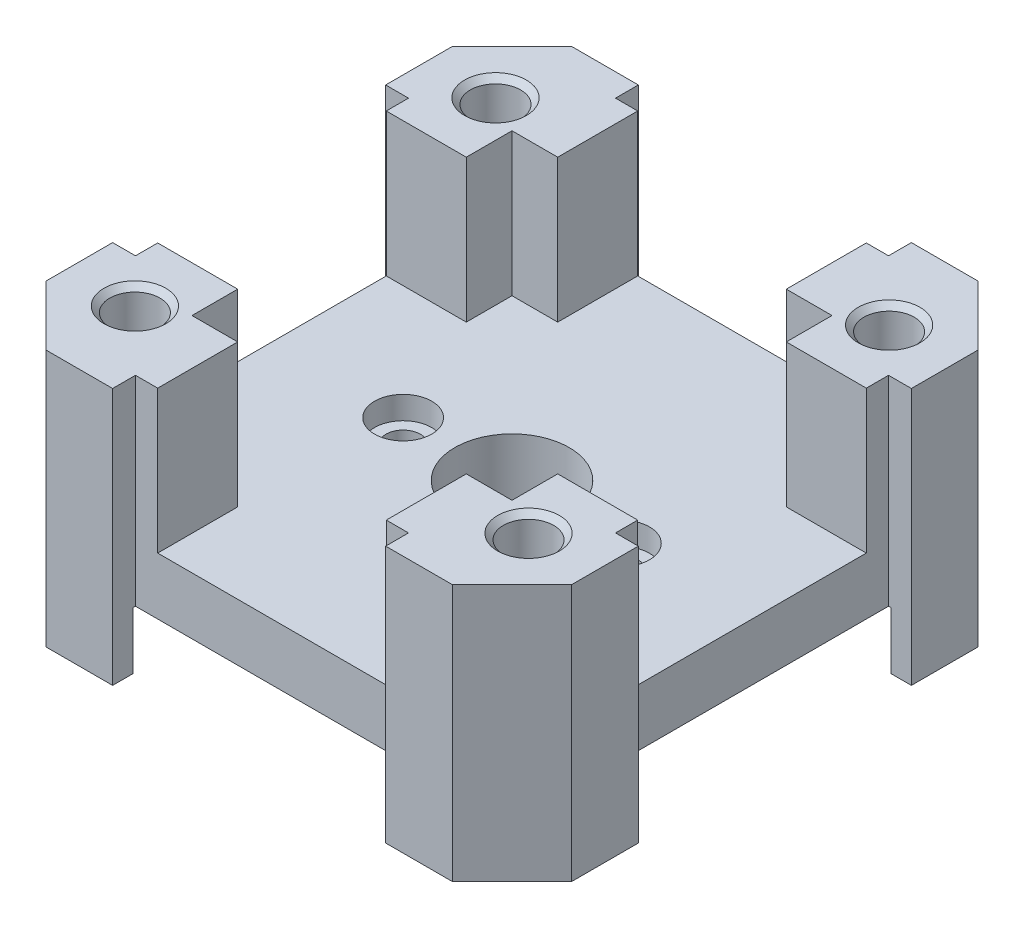
from build123d import *

# Parameters (mm, degrees)
SKETCH1_R               = 1.5
SKETCH1_R_2             = 5
BOSS_EXTRUDE1_DEPTH     = 5
SKETCH2_W               = 28
SKETCH2_H               = 28
BOSS_EXTRUDE2_DEPTH     = 12.5
SKETCH3_R               = 2.2
CUT_EXTRUDE1_DEPTH      = 6
CUT_EXTRUDE2_DEPTH      = 62.921321045
CUT_EXTRUDE2_DEPTH_BACK = 62.921321045
SKETCH4_W               = 20
SKETCH4_H               = 23.078544061
CUT_EXTRUDE3_DEPTH      = 62.921321045
CUT_EXTRUDE3_DEPTH_BACK = 62.921321045
SKETCH5_W               = 20
SKETCH5_H               = 13.366359074
BOSS_EXTRUDE3_START     = -17.5
BOSS_EXTRUDE3_DEPTH     = 22.5
SKETCH8_R               = 2.5
CUT_EXTRUDE4_DEPTH      = 2
CUT_EXTRUDE5_DEPTH      = 5
FILLET1_R               = 0.5
CHAMFER1_SIZE           = 0.5


with BuildPart() as part:
    # Sketch1 → Boss-Extrude1 (new body)
    with BuildSketch(Plane(origin=(0, 0, 0), x_dir=(1, 0, 0), z_dir=(0, 1, 0))):
        Polygon((4.055, 0), (37.945, 0), (42, 4.055), (42, 37.945), (37.945, 42), (4.055, 42), (0, 37.945), (0, 4.055), align=None)
        with Locations(Location((11.475, 21, 0), (0, 0, 270))):
            Circle(SKETCH1_R, mode=Mode.SUBTRACT)
        with Locations(Location((30.525, 21, 0), (0, 0, 270))):
            Circle(SKETCH1_R, mode=Mode.SUBTRACT)
        with Locations(Location((21, 21, 0), (0, 0, 270))):
            Circle(SKETCH1_R_2, mode=Mode.SUBTRACT)
    extrude(amount=BOSS_EXTRUDE1_DEPTH)

    # Sketch2 → Boss-Extrude2 (add)
    with BuildSketch(Plane(origin=(0, 5, 0), x_dir=(1, 0, 0), z_dir=(0, 1, 0))):
        Polygon((37.945, 42), (4.055, 42), (0, 37.945), (0, 4.055), (4.055, 0), (37.945, 0), (42, 4.055), (42, 37.945), align=None)
        with Locations((21, 21)):
            Rectangle(SKETCH2_W, SKETCH2_H, mode=Mode.SUBTRACT)
    extrude(amount=BOSS_EXTRUDE2_DEPTH)

    # Sketch3 → Cut-Extrude1 (cut)
    with BuildSketch(Plane(origin=(0, 17.5, 0), x_dir=(1, 0, 0), z_dir=(0, 1, 0))):
        with Locations(Location((3.779747468, 36.775, 0), (0, 0, 270))):
            Circle(SKETCH3_R)
        with Locations(Location((3.779747468, 5.225, 0), (0, 0, 270))):
            Circle(SKETCH3_R)
        with Locations(Location((38.220252532, 5.225, 0), (0, 0, 90))):
            Circle(SKETCH3_R)
        with Locations(Location((38.220252532, 36.775, 0), (0, 0, 90))):
            Circle(SKETCH3_R)
    extrude(amount=-CUT_EXTRUDE1_DEPTH, mode=Mode.SUBTRACT)

    # Sketch4 → Cut-Extrude2 (cut, two sides: drawn at the far end of the back side and taken through both)
    with BuildSketch(Plane.ZY.offset(-CUT_EXTRUDE2_DEPTH_BACK)):
        with Locations((-21, 16.539272031)):
            Rectangle(SKETCH4_W, SKETCH4_H)
    extrude(amount=CUT_EXTRUDE2_DEPTH + CUT_EXTRUDE2_DEPTH_BACK, mode=Mode.SUBTRACT)

    # Sketch5 → Cut-Extrude3 (cut, two sides: drawn at the far end of the back side and taken through both)
    with BuildSketch(Plane(origin=(0, 0, -42), x_dir=(-1, 0, 0), z_dir=(0, 0, -1)).offset(-CUT_EXTRUDE3_DEPTH_BACK)):
        with Locations((-21, 11.683179537)):
            Rectangle(SKETCH5_W, SKETCH5_H)
    extrude(amount=CUT_EXTRUDE3_DEPTH + CUT_EXTRUDE3_DEPTH_BACK, mode=Mode.SUBTRACT)

    # Sketch7 → Boss-Extrude3 (add)
    with BuildSketch(Plane.XZ.offset(BOSS_EXTRUDE3_START)):
        Polygon((37.945, 0), (32.945, 0), (32.945, 2), (38.773427125, 2), (44, -3.226572875), (44, -9.055), (42, -9.055), (42, -4.055), align=None)
        Polygon((4.055, 0), (0, -4.055), (0, -9.055), (-2, -9.055), (-2, -3.226572875), (3.226572875, 2), (9.055, 2), (9.055, 0), align=None)
        Polygon((0, -37.945), (4.055, -42), (9.055, -42), (9.055, -44), (3.226572875, -44), (-2, -38.773427125), (-2, -32.945), (0, -32.945), align=None)
        Polygon((37.945, -42), (42, -37.945), (42, -32.945), (44, -32.945), (44, -38.773427125), (38.773427125, -44), (32.945, -44), (32.945, -42), align=None)
    extrude(amount=BOSS_EXTRUDE3_DEPTH)

    # Sketch8 → Cut-Extrude4 (cut)
    with BuildSketch(Plane(origin=(0, 5, 0), x_dir=(1, 0, 0), z_dir=(0, 1, 0))):
        with Locations(Location((11.475, 21, 0), (0, 0, 270))):
            Circle(SKETCH8_R)
        with Locations(Location((30.525, 21, 0), (0, 0, 270))):
            Circle(SKETCH8_R)
    extrude(amount=-CUT_EXTRUDE4_DEPTH, mode=Mode.SUBTRACT)

    # Sketch9 → Cut-Extrude5 (cut)
    with BuildSketch(Plane.XZ.offset(5)):
        Polygon((-0.2, -9.055), (-0.2, -3.972157288), (3.972157288, 0.2), (38.027842712, 0.2), (42.2, -3.972157288), (42.2, -38.027842712), (38.027842712, -42.2), (3.972157288, -42.2), (-0.2, -38.027842712), align=None)
    extrude(amount=-CUT_EXTRUDE5_DEPTH, mode=Mode.SUBTRACT)

    # Fillet1
    fillet1_edges = [part.edges().sort_by_distance(p)[0] for p in [
        (3.972157288, -2.5, 0.2),
        (-0.2, -2.5, -38.027842712),
        (-0.2, -2.5, -3.972157288),
        (38.027842712, -2.5, 0.2),
        (42.2, -2.5, -3.972157288),
        (42.2, -2.5, -38.027842712),
        (38.027842712, -2.5, -42.2),
        (3.972157288, -2.5, -42.2),
    ]]
    fillet(fillet1_edges, radius=FILLET1_R)

    # Chamfer1
    chamfer1_edges = [part.edges().sort_by_distance(p)[0] for p in [
        (38.220252532, 17.5, -34.575),
        (38.220252532, 17.5, -3.025),
        (3.779747468, 17.5, -7.425),
        (3.779747468, 17.5, -38.975),
    ]]
    chamfer(chamfer1_edges, length=CHAMFER1_SIZE)


solid = part.part
